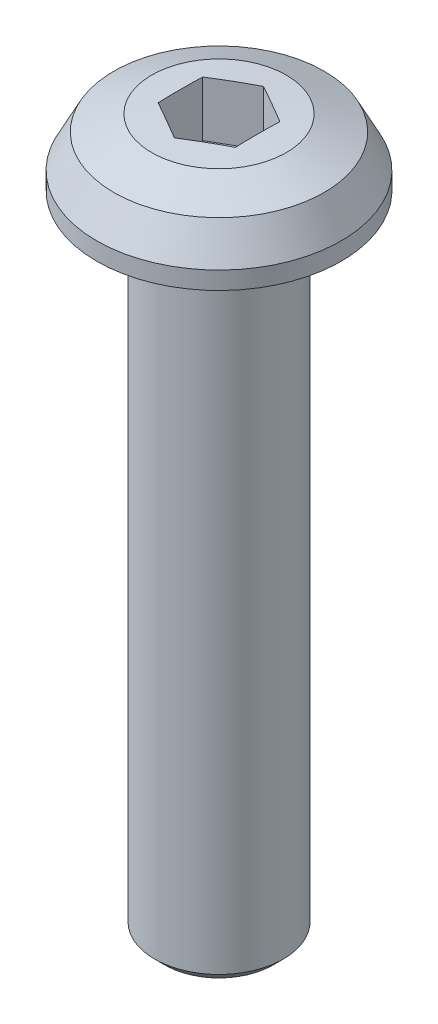
from build123d import *

# Parameters (mm, degrees)
CUT_EXTRUDE1_DEPTH = 2.25


with BuildPart() as part:
    # Sketch1 → Revolve1 (revolve)
    with BuildSketch(Plane.XY, mode=Mode.PRIVATE) as revolve1_sk:
        Polygon((0, -25), (2.1, -25), (2.5, -24.6), (2.5, 0), (4.75, 0), (4.75, 0.6875), (4.085, 1.98), (2.6125, 2.585), (0, 2.75), align=None)
    revolve(revolve1_sk.sketch.rotate(Axis((0, -10, 0), (0, 1, 0)), 90), axis=Axis((0, -10, 0), (0, 1, 0)))

    # Sketch2 → Cut-Extrude1 (cut)
    with BuildSketch(Plane(origin=(0, 2.75, 0), x_dir=(1, 0, 0), z_dir=(0, 1, 0))):
        Polygon((1.5, -0.866025404), (0, -1.732050808), (-1.5, -0.866025404), (-1.5, 0.866025404), (0, 1.732050808), (1.5, 0.866025404), align=None)
    extrude(amount=-CUT_EXTRUDE1_DEPTH, mode=Mode.SUBTRACT)


solid = part.part
